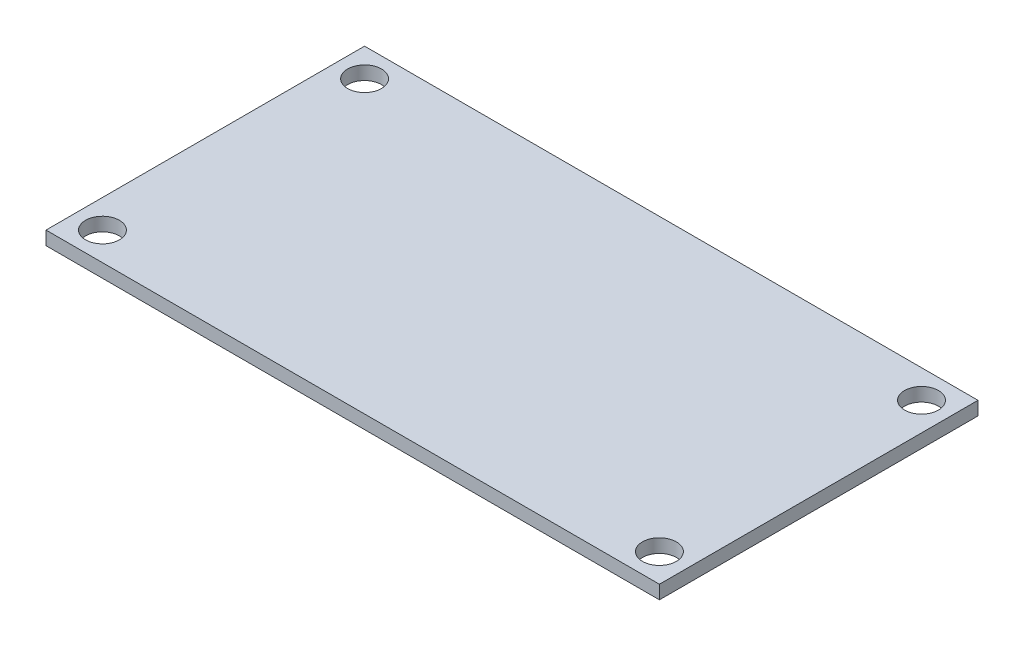
from build123d import *

# Parameters (mm, degrees)
CROQUIS1_W              = 54.3
CROQUIS1_H              = 28.2
SALIENTE_EXTRUIR1_DEPTH = 1.2
CROQUIS3_R              = 1.5
CORTAR_EXTRUIR1_DEPTH   = 1.2


with BuildPart() as part:
    # Croquis1 → Saliente-Extruir1 (new body)
    with BuildSketch(Plane(origin=(0, 0, 0), x_dir=(1, 0, 0), z_dir=(0, 1, 0))):
        Rectangle(CROQUIS1_W, CROQUIS1_H)
    extrude(amount=SALIENTE_EXTRUIR1_DEPTH)

    # Croquis3 → Cortar-Extruir1 (cut)
    with BuildSketch(Plane(origin=(0, 1.2, 0), x_dir=(1, 0, 0), z_dir=(0, 1, 0))):
        with Locations(Location((-24.65, 11.6, 0), (0, 0, 270))):
            Circle(CROQUIS3_R)
        with Locations(Location((24.65, 11.6, 0), (0, 0, 90))):
            Circle(CROQUIS3_R)
        with Locations(Location((24.65, -11.6, 0), (0, 0, 270))):
            Circle(CROQUIS3_R)
        with Locations(Location((-24.65, -11.6, 0), (0, 0, 90))):
            Circle(CROQUIS3_R)
    extrude(amount=-CORTAR_EXTRUIR1_DEPTH, mode=Mode.SUBTRACT)


solid = part.part
